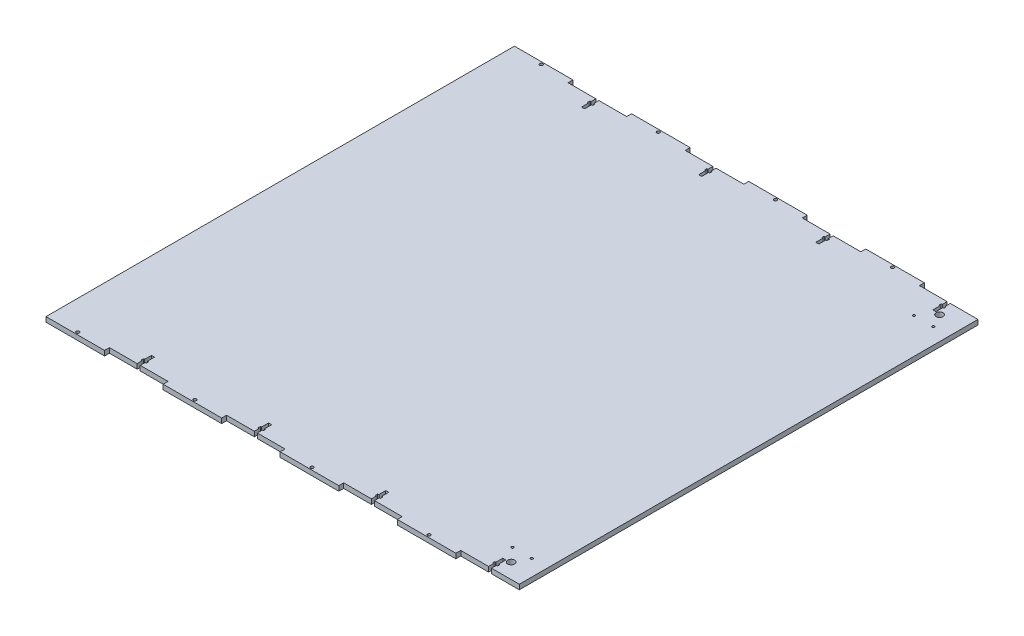
from build123d import *

# Parameters (mm, degrees)
SKETCH1_W           = 609.6
SKETCH1_H           = 304.8
BOSS_EXTRUDE1_DEPTH = 3.175
CUT_EXTRUDE1_START  = -10
SKETCH2_R           = 2
SKETCH2_R_2         = 4.5
SKETCH2_R_3         = 1.5
CUT_EXTRUDE1_DEPTH  = 12.54


with BuildPart() as part:
    # Sketch1 → Boss-Extrude1 (new, symmetric)
    with BuildSketch(Plane(origin=(0, 0, 0), x_dir=(1, 0, 0), z_dir=(0, 1, 0))):
        with Locations((0, -152.4)):
            Rectangle(SKETCH1_W, SKETCH1_H)
    boss_extrude1 = extrude(amount=BOSS_EXTRUDE1_DEPTH, both=True)

    # Sketch2 → Cut-Extrude1 (cut)
    with BuildSketch(Plane(origin=(0, 3.175, 0), x_dir=(1, 0, 0), z_dir=(0, 1, 0)).offset(CUT_EXTRUDE1_START)):
        with Locations(Location((-266.7, -301.625, 0), (0, 0, 270))):
            Circle(SKETCH2_R)
        Polygon((-228.6, -298.45), (-228.6, -304.8), (-152.4, -304.8), (-152.4, -298.45), (-188.5, -298.45), (-192.5, -298.45), align=None)
        Polygon((-192.5, -292.05), (-192.5, -298.45), (-188.5, -298.45), (-188.5, -292.05), (-187.11, -292.05), (-187.11, -288.85), (-188.5, -288.85), (-188.5, -279.8), (-192.5, -279.8), (-192.5, -288.85), (-193.89, -288.85), (-193.89, -292.05), align=None)
        with Locations(Location((-114.3, -301.625, 0), (0, 0, 270))):
            Circle(SKETCH2_R)
        Polygon((-76.2, -298.45), (-76.2, -304.8), (0, -304.8), (0, -298.45), (-36.1, -298.45), (-40.1, -298.45), align=None)
        Polygon((-40.1, -292.05), (-40.1, -298.45), (-36.1, -298.45), (-36.1, -292.05), (-34.71, -292.05), (-34.71, -288.85), (-36.1, -288.85), (-36.1, -279.8), (-40.1, -279.8), (-40.1, -288.85), (-41.49, -288.85), (-41.49, -292.05), align=None)
        with Locations(Location((38.1, -301.625, 0), (0, 0, 270))):
            Circle(SKETCH2_R)
        Polygon((76.2, -298.45), (76.2, -304.8), (152.4, -304.8), (152.4, -298.45), (116.3, -298.45), (112.3, -298.45), align=None)
        Polygon((112.3, -292.05), (112.3, -298.45), (116.3, -298.45), (116.3, -292.05), (117.69, -292.05), (117.69, -288.85), (116.3, -288.85), (116.3, -279.8), (112.3, -279.8), (112.3, -288.85), (110.91, -288.85), (110.91, -292.05), align=None)
        with Locations(Location((190.5, -301.625, 0), (0, 0, 270))):
            Circle(SKETCH2_R)
        Polygon((228.6, -298.45), (228.6, -304.8), (304.8, -304.8), (304.8, -298.45), (268.7, -298.45), (264.7, -298.45), align=None)
        Polygon((264.7, -292.05), (264.7, -298.45), (268.7, -298.45), (268.7, -292.05), (270.09, -292.05), (270.09, -288.85), (268.7, -288.85), (268.7, -279.8), (264.7, -279.8), (264.7, -288.85), (263.31, -288.85), (263.31, -292.05), align=None)
        with Locations(Location((274.46, -278.775, 0), (0, 0, 270))):
            Circle(SKETCH2_R_2)
        with Locations(Location((283.8, -261.3, 0), (0, 0, 270))):
            Circle(SKETCH2_R_3)
        with Locations(Location((258.8, -261.3, 0), (0, 0, 270))):
            Circle(SKETCH2_R_3)
    cut_extrude1 = extrude(amount=CUT_EXTRUDE1_DEPTH, mode=Mode.SUBTRACT)

    # Mirror1: Boss-Extrude1, Cut-Extrude1 across plane
    add(boss_extrude1.mirror(Plane(origin=(0, 3.175, 0), x_dir=(1, 0, 0), z_dir=(0, 0, -1))))
    add(cut_extrude1.mirror(Plane(origin=(0, 3.175, 0), x_dir=(1, 0, 0), z_dir=(0, 0, -1))), mode=Mode.SUBTRACT)


solid = part.part
